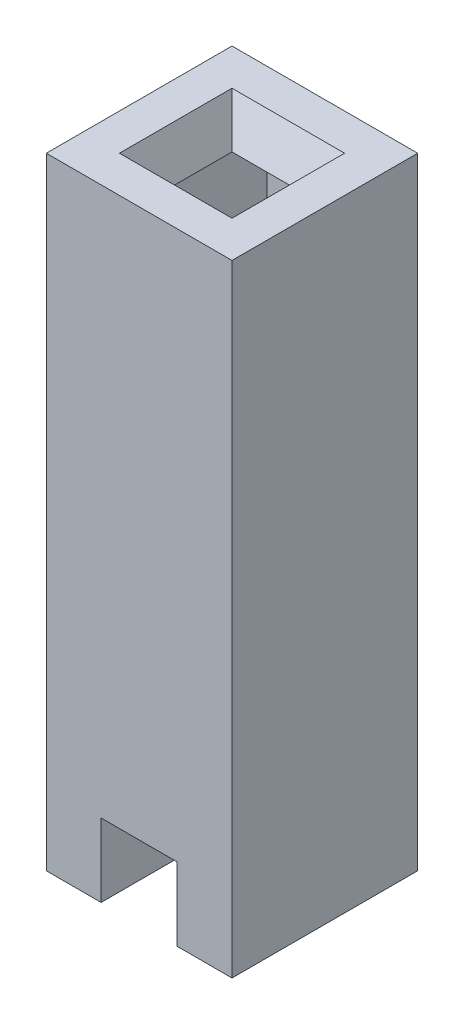
from build123d import *

# Parameters (mm, degrees)
BOSS_EXTRUDE1_DEPTH = 2.54
SKETCH2_W           = 1.04
SKETCH2_H           = 2
CUT_EXTRUDE1_DEPTH  = 7
SKETCH3_W           = 1.54
SKETCH3_H           = 1.54
CUT_EXTRUDE2_DEPTH  = 0.5
CUT_EXTRUDE2_DRAFT  = -27


with BuildPart() as part:
    # Sketch1 → Boss-Extrude1 (new body)
    with BuildSketch(Plane.XY):
        Polygon((-1.79, 0), (-2.54, 0), (-2.54, 8.5), (0, 8.5), (0, 0), (-0.75, 0), (-0.75, 1), (-1.79, 1), align=None)
    extrude(amount=BOSS_EXTRUDE1_DEPTH)

    # Sketch2 → Cut-Extrude1 (cut)
    with BuildSketch(Plane.XZ.offset(-1)):
        with Locations((-1.27, 1.27)):
            Rectangle(SKETCH2_W, SKETCH2_H)
    extrude(amount=-CUT_EXTRUDE1_DEPTH, mode=Mode.SUBTRACT)


with BuildPart() as cut_extrude2_tool:
    # Sketch3 → Cut-Extrude2 (with draft: the straight prism first)
    with BuildSketch(Plane(origin=(0, 8.5, 0), x_dir=(1, 0, 0), z_dir=(0, 1, 0))):
        with Locations((-1.27, -1.27)):
            Rectangle(SKETCH3_W, SKETCH3_H)
    extrude(amount=-CUT_EXTRUDE2_DEPTH)
    # Cut-Extrude2: the draft: its side faces are tilted about the plane it starts from
    cut_extrude2_sides = [cut_extrude2_tool.faces().sort_by_distance(p)[0] for p in [
        (-1.27, 8.25, 0.5),
        (-2.04, 8.25, 1.27),
        (-1.27, 8.25, 2.04),
        (-0.5, 8.25, 1.27),
    ]]
    draft(cut_extrude2_sides, Plane(origin=(0, 8.5, 0), x_dir=(1, 0, 0), z_dir=(0, 1, 0)), CUT_EXTRUDE2_DRAFT)


with BuildPart() as part_1:
    add(part.part)

    # Cut-Extrude2: cut by cut_extrude2_tool
    add(cut_extrude2_tool.part, mode=Mode.SUBTRACT)


solid = part_1.part
